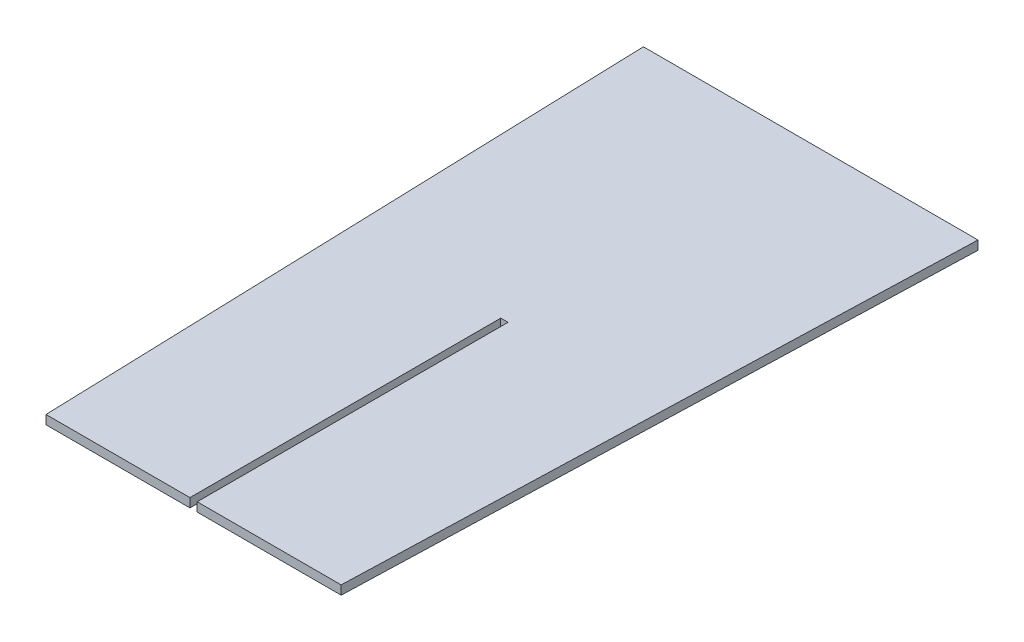
from build123d import *

# Parameters (mm, degrees)
BOSS_EXTRUDE1_DEPTH = 6.35
SKETCH2_W           = 27.9781
SKETCH2_H           = 17.4625
BOSS_EXTRUDE2_DEPTH = 6.35


with BuildPart() as part:
    # Sketch1 → Boss-Extrude1 (new body)
    with BuildSketch(Plane(origin=(0, 0, 0), x_dir=(1, 0, 0), z_dir=(0, 1, 0))):
        Polygon((262.669201475, 448.360447089), (367.463251475, 448.360447089), (367.463251475, 430.897947089), (395.441351475, 430.897947089), (395.441351475, 448.360447089), (500.235401475, 448.360447089), (486.227301475, 10.210447089), (384.031988975, 10.210447089), (384.031988975, 230.872947089), (378.872613975, 230.872947089), (378.872613975, 10.210447089), (276.677301475, 10.210447089), align=None)
    extrude(amount=-BOSS_EXTRUDE1_DEPTH)

    # Sketch2 → Boss-Extrude2 (add)
    with BuildSketch(Plane(origin=(0, 0, 0), x_dir=(1, 0, 0), z_dir=(0, 1, 0))):
        with Locations((381.452301475, 439.629197089)):
            Rectangle(SKETCH2_W, SKETCH2_H)
    extrude(amount=-BOSS_EXTRUDE2_DEPTH)


solid = part.part
